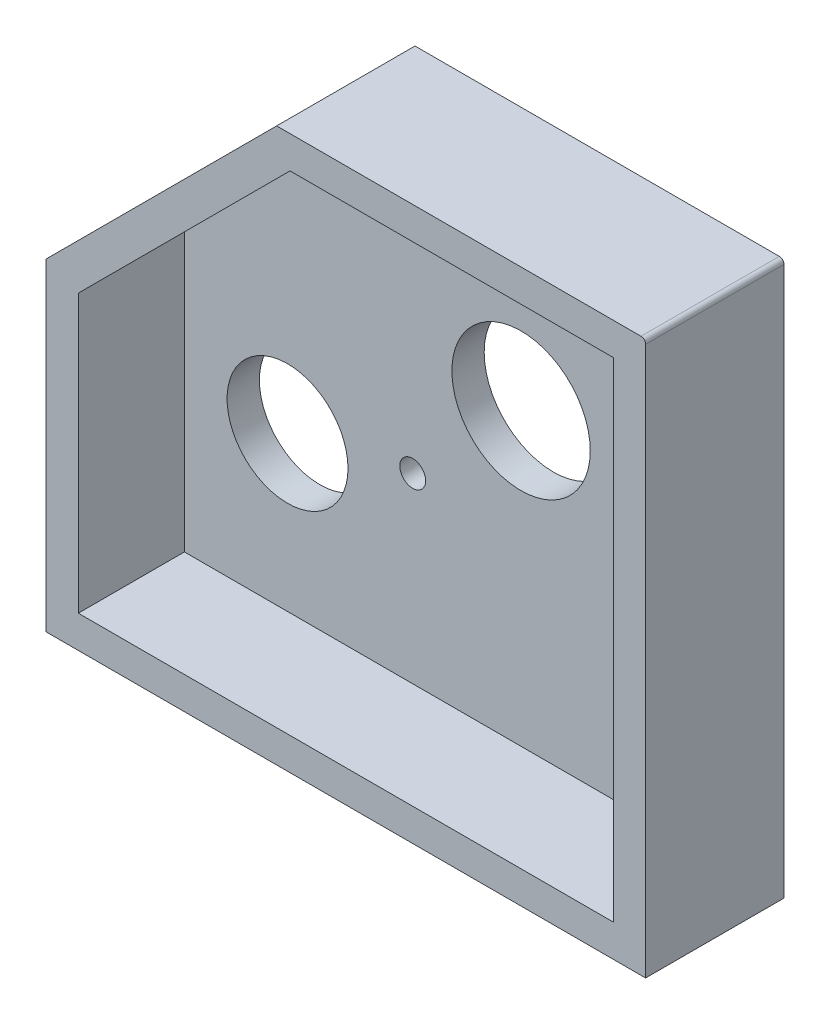
from build123d import *

# Parameters (mm, degrees)
BOSS_EXTRUDE1_DEPTH  = 30
SHELL1_T             = -7
SKETCH2_R            = 15
CUT_EXTRUDE1_DEPTH   = 20
SKETCH3_R            = 2.805999004
CUT_EXTRUDE2_DEPTH   = 20
LPATTERN1_COUNT      = 2
LPATTERN1_PITCH      = 47
LPATTERN1_COUNT_DIR2 = 2
LPATTERN1_PITCH_DIR2 = 47
SKETCH4_R            = 13.106496876
CUT_EXTRUDE3_DEPTH   = 20


with BuildPart() as part:
    # Sketch1 → Boss-Extrude1 (new body)
    with BuildSketch(Plane.XY):
        with BuildLine():
            Line((-98.588677058, 20.737627793), (-48.588677058, 70.737627793))
            Line((-48.588677058, 70.737627793), (30.411322942, 70.737627793))
            ThreePointArc((30.411322942, 70.737627793), (31.118429723, 70.444734574), (31.411322942, 69.737627793))
            Line((31.411322942, 69.737627793), (31.411322942, -49.262372207))
            Line((31.411322942, -49.262372207), (-98.588677058, -49.262372207))
            Line((-98.588677058, -49.262372207), (-98.588677058, 20.737627793))
        make_face()
    extrude(amount=BOSS_EXTRUDE1_DEPTH)

    # Shell1
    shell1_openings = [part.faces().sort_by_distance(p)[0] for p in [
        (-29.379362159, 6.961996775, 30),
    ]]
    offset(amount=SHELL1_T, openings=shell1_openings, kind=Kind.INTERSECTION)

    # Sketch2 → Cut-Extrude1 (cut)
    with BuildSketch(Plane.XY.offset(7)):
        with Locations((-18.588677058, 20.737627793)):
            Circle(SKETCH2_R)
    extrude(amount=-CUT_EXTRUDE1_DEPTH, mode=Mode.SUBTRACT)

    # Sketch3 → Cut-Extrude2 (cut)
    with BuildSketch(Plane.XY.offset(7)):
        with Locations((-42.088677058, 44.237627793)):
            Circle(SKETCH3_R)
    cut_extrude2 = extrude(amount=-CUT_EXTRUDE2_DEPTH, mode=Mode.SUBTRACT)

    # LPattern1: Cut-Extrude2 2 × 2
    with Locations(*[(i * LPATTERN1_PITCH, -j * LPATTERN1_PITCH_DIR2, 0) for i in range(LPATTERN1_COUNT) for j in range(LPATTERN1_COUNT_DIR2) if (i, j) != (0, 0)]):
        add(cut_extrude2, mode=Mode.SUBTRACT)

    # Sketch4 → Cut-Extrude3 (cut)
    with BuildSketch(Plane.XY.offset(7)):
        with Locations((-69.22336781, -8.843391448)):
            Circle(SKETCH4_R)
    extrude(amount=-CUT_EXTRUDE3_DEPTH, mode=Mode.SUBTRACT)


solid = part.part
